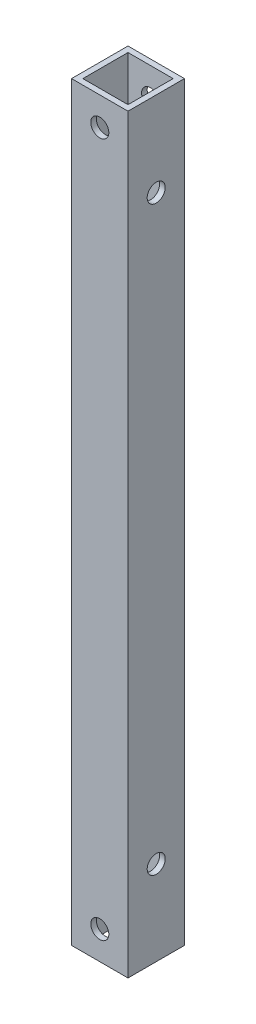
from build123d import *

# Parameters (mm, degrees)
SKETCH_1_W          = 10
SKETCH_1_H          = 133
SKETCH_1_R          = 1.6
EXTRUDE_1_DEPTH     = 10
SKETCH_2_R          = 1.6
CUT_EXTRUDE_1_DEPTH = 15
SKETCH_3_W          = 8
SKETCH_3_H          = 8
CUT_EXTRUDE_2_DEPTH = 1000


with BuildPart() as part:
    # ｽｹｯﾁ1 → ﾎﾞｽ - 押し出し1 (new body)
    with BuildSketch(Plane.XY):
        with Locations((22.499828612, -66.5)):
            Rectangle(SKETCH_1_W, SKETCH_1_H)
        with Locations((22.499828612, -5)):
            Circle(SKETCH_1_R, mode=Mode.SUBTRACT)
        with Locations((22.499828612, -128)):
            Circle(SKETCH_1_R, mode=Mode.SUBTRACT)
    extrude(amount=EXTRUDE_1_DEPTH)

    # ｽｹｯﾁ2 → ｶｯﾄ - 押し出し1 (cut)
    with BuildSketch(Plane(origin=(27.499828612, 0, 0), x_dir=(0, 0, -1), z_dir=(1, 0, 0))):
        with Locations(Location((-5, -118, 0), (0, 0, 90))):
            Circle(SKETCH_2_R)
        with Locations(Location((-5, -15, 0), (0, 0, 90))):
            Circle(SKETCH_2_R)
    extrude(amount=-CUT_EXTRUDE_1_DEPTH, mode=Mode.SUBTRACT)

    # ｽｹｯﾁ3 → ｶｯﾄ - 押し出し2 (cut)
    with BuildSketch(Plane.XZ.offset(133)):
        with Locations((22.499828612, 5)):
            Rectangle(SKETCH_3_W, SKETCH_3_H)
    extrude(amount=-CUT_EXTRUDE_2_DEPTH, mode=Mode.SUBTRACT)


solid = part.part
